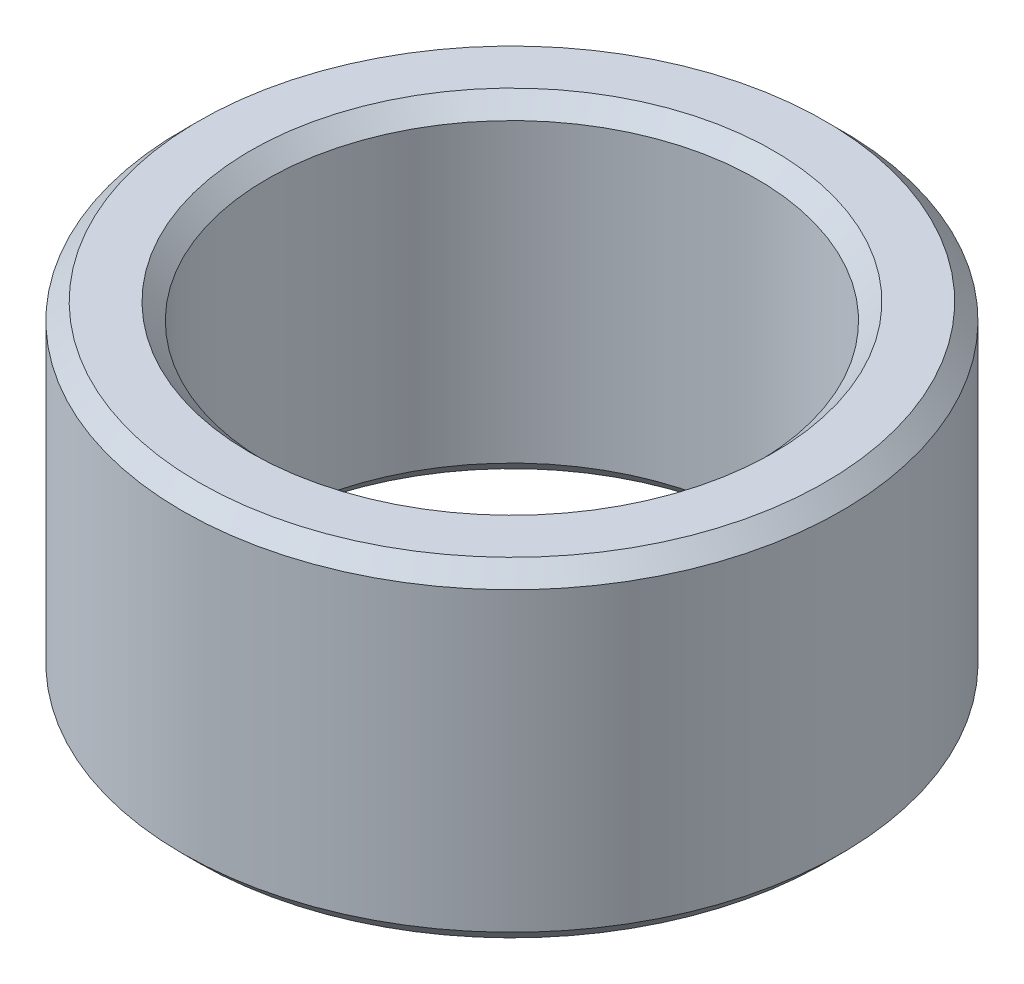
from build123d import *

# Parameters (mm, degrees)
SKETCH_1_R      = 4
SKETCH_1_R_2    = 2.975
EXTRUDE_1_DEPTH = 4
CHAMFER_1_SIZE  = 0.2


with BuildPart() as part:
    # 草图1 → 凸台-拉伸1 (new body)
    with BuildSketch(Plane(origin=(0, 0, 0), x_dir=(1, 0, 0), z_dir=(0, 1, 0))):
        with Locations(Location((0, 0, 0), (0, 0, 270))):
            Circle(SKETCH_1_R)
        with Locations(Location((0, 0, 0), (0, 0, 270))):
            Circle(SKETCH_1_R_2, mode=Mode.SUBTRACT)
    extrude(amount=EXTRUDE_1_DEPTH)

    # 倒角1
    chamfer_1_edges = [part.edges().sort_by_distance(p)[0] for p in [
        (0, 0, -4),
        (0, 4, -4),
        (0, 0, -2.975),
        (0, 4, -2.975),
    ]]
    chamfer(chamfer_1_edges, length=CHAMFER_1_SIZE)


solid = part.part
